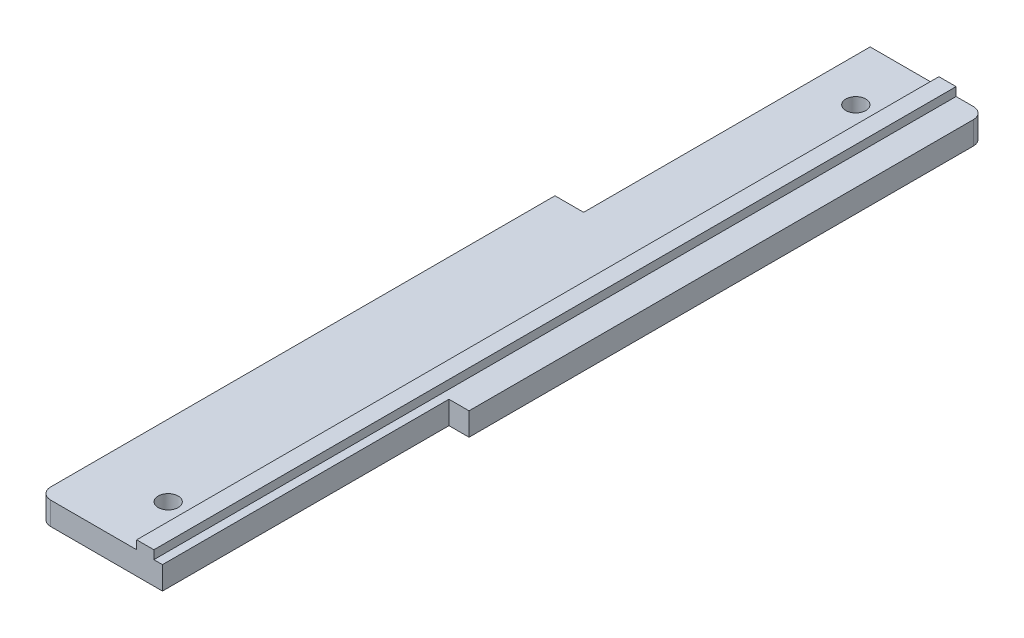
from build123d import *

# Parameters (mm, degrees)
SKETCH_1_W          = 25
SKETCH_1_H          = 140
EXTRUDE_1_DEPTH     = 4
FILLET_1_R          = 2
SKETCH_4_R          = 1.75
CUT_EXTRUDE_1_DEPTH = 10
SKETCH_6_W          = 3
SKETCH_6_H          = 140
EXTRUDE_3_DEPTH     = 1.5
SKETCH_7_W          = 20.611875048
SKETCH_7_H          = 50
CUT_EXTRUDE_2_DEPTH = 10
SKETCH_8_W          = 3.5
SKETCH_8_H          = 50
CUT_EXTRUDE_3_DEPTH = 45


with BuildPart() as part:
    # 草图1 → 凸台-拉伸1 (new body)
    with BuildSketch(Plane(origin=(0, 0, 0), x_dir=(1, 0, 0), z_dir=(0, 1, 0))):
        Rectangle(SKETCH_1_W, SKETCH_1_H)
    extrude(amount=EXTRUDE_1_DEPTH)

    # 圆角1
    fillet_1_edges = [part.edges().sort_by_distance(p)[0] for p in [
        (12.5, 2, 70),
        (-12.5, 2, 70),
        (-12.5, 2, -70),
        (12.5, 2, -70),
    ]]
    fillet(fillet_1_edges, radius=FILLET_1_R)

    # 草图4 → 切除-拉伸1 (cut)
    with BuildSketch(Plane(origin=(0, 4, 0), x_dir=(1, 0, 0), z_dir=(0, 1, 0))):
        with Locations(Location((0, 60, 0), (0, 0, 270))):
            Circle(SKETCH_4_R)
        with Locations(Location((0, -60, 0), (0, 0, 90))):
            Circle(SKETCH_4_R)
    extrude(amount=-CUT_EXTRUDE_1_DEPTH, mode=Mode.SUBTRACT)

    # 草图6 → 凸台-拉伸3 (add)
    with BuildSketch(Plane(origin=(0, 4, 0), x_dir=(1, 0, 0), z_dir=(0, 1, 0))):
        with Locations((6, 0)):
            Rectangle(SKETCH_6_W, SKETCH_6_H)
    extrude(amount=EXTRUDE_3_DEPTH)

    # 草图7 → 切除-拉伸2 (cut)
    with BuildSketch(Plane(origin=(0, 4, 0), x_dir=(1, 0, 0), z_dir=(0, 1, 0))):
        with Locations((-17.805937524, 45)):
            Rectangle(SKETCH_7_W, SKETCH_7_H)
    extrude(amount=-CUT_EXTRUDE_2_DEPTH, mode=Mode.SUBTRACT)

    # 草图8 → 切除-拉伸3 (cut)
    with BuildSketch(Plane(origin=(0, 4, 0), x_dir=(1, 0, 0), z_dir=(0, 1, 0))):
        with Locations((10.75, -45)):
            Rectangle(SKETCH_8_W, SKETCH_8_H)
    extrude(amount=-CUT_EXTRUDE_3_DEPTH, mode=Mode.SUBTRACT)


solid = part.part
